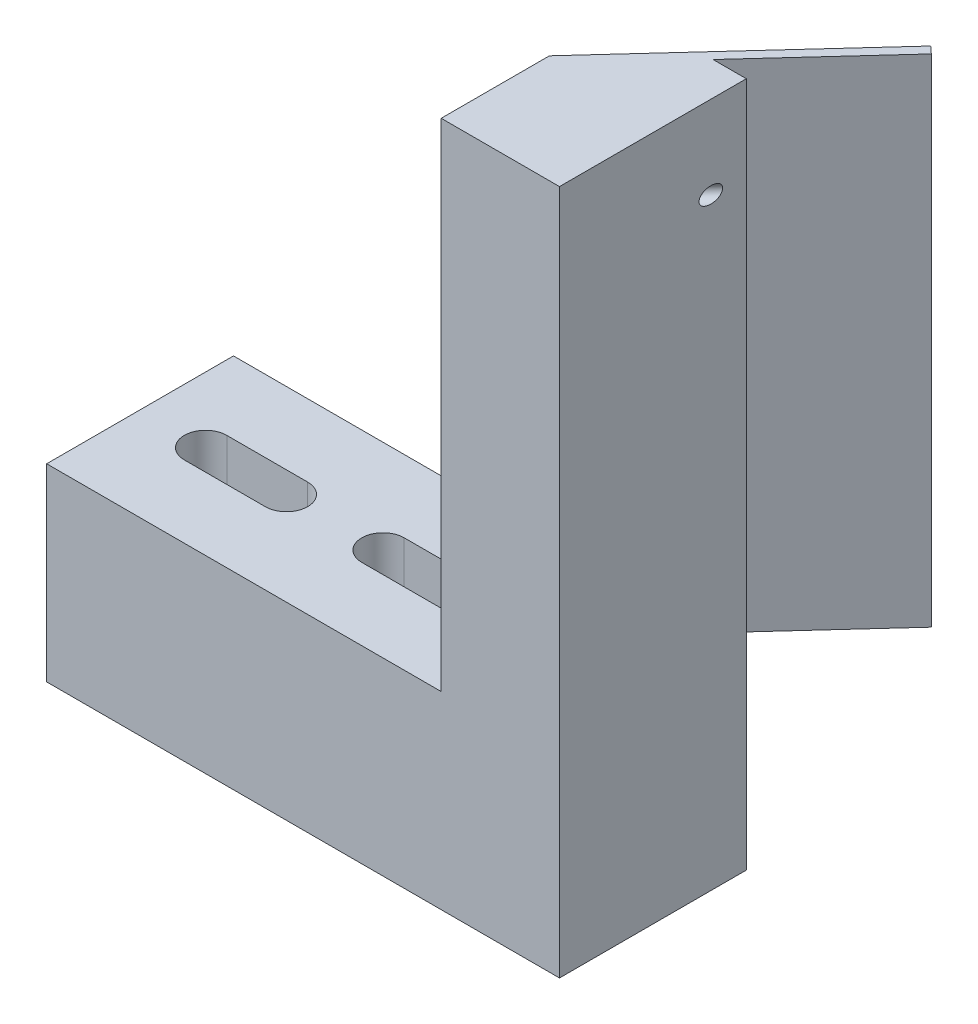
from build123d import *

# Parameters (mm, degrees)
SKETCH1_W           = 48.26
SKETCH1_H           = 17.78
BOSS_EXTRUDE1_DEPTH = 17.579999892
BOSS_EXTRUDE4_DEPTH = 46.720000032
CUT_EXTRUDE1_DEPTH  = 70.432286432
BOSS_EXTRUDE5_DEPTH = 46.72
SKETCH9_W           = 0.75
SKETCH9_H           = 25.854438162


with BuildPart() as part:
    # Sketch1 → Boss-Extrude1 (new body)
    with BuildSketch(Plane.XY):
        with Locations((24.13, 8.89)):
            Rectangle(SKETCH1_W, SKETCH1_H)
    extrude(amount=-BOSS_EXTRUDE1_DEPTH)

    # Sketch3 → Boss-Extrude4 (add)
    with BuildSketch(Plane(origin=(0, 17.78, 0), x_dir=(1, 0, 0), z_dir=(0, 1, 0))):
        Polygon((37.801769271, 9.565696577), (37.128446266, 10.181556346), (37.128446266, 0), (48.26, 0), (48.26, 13.587965792), (48.26, 17.579999892), (45.132109917, 17.579999892), align=None)
    extrude(amount=BOSS_EXTRUDE4_DEPTH)

    # Sketch4 → Cut-Extrude1 (cut, through all)
    with BuildSketch(Plane(origin=(0, 17.78, 0), x_dir=(1, 0, 0), z_dir=(0, 1, 0))):
        with BuildLine():
            Line((30.48, 6.789), (22.86, 6.789))
            ThreePointArc((22.86, 6.789), (20.86, 8.789), (22.86, 10.789))
            Line((22.86, 10.789), (30.48, 10.789))
            ThreePointArc((30.48, 10.789), (32.48, 8.789), (30.48, 6.789))
        make_face()
        with BuildLine():
            Line((13.78, 6.789), (6.16, 6.789))
            ThreePointArc((6.16, 6.789), (4.16, 8.789), (6.16, 10.789))
            Line((6.16, 10.789), (13.78, 10.789))
            ThreePointArc((13.78, 10.789), (15.78, 8.789), (13.78, 6.789))
        make_face()
    extrude(amount=-CUT_EXTRUDE1_DEPTH, mode=Mode.SUBTRACT)

    # Sketch3<7> → Boss-Extrude5 (add, through all)
    with BuildSketch(Plane(origin=(0, 17.78, 0), x_dir=(1, 0, 0), z_dir=(0, 1, 0))):
        Polygon((54.944699529, 28.308160187), (54.271376524, 28.924019957), (37.128446266, 10.181556346), (37.801769271, 9.565696577), align=None)
    extrude(amount=BOSS_EXTRUDE5_DEPTH)

    # Sketch9 → Ø1.5mm Dowel Hole1 (revolve, cut)
    with BuildSketch(Plane(origin=(41.16709667, 56.699990232, -6.487575467), x_dir=(0.7378922681206892, 0, 0.6749185140798146), z_dir=(0, 1, 0))):
        with Locations((0.375, 12.927219081)):
            Rectangle(SKETCH9_W, SKETCH9_H)
    revolve(axis=Axis((36.881364106, 56.699990232, -1.801959564), (0.6749185140798145, 0, -0.7378922681206892)), mode=Mode.SUBTRACT)


solid = part.part
